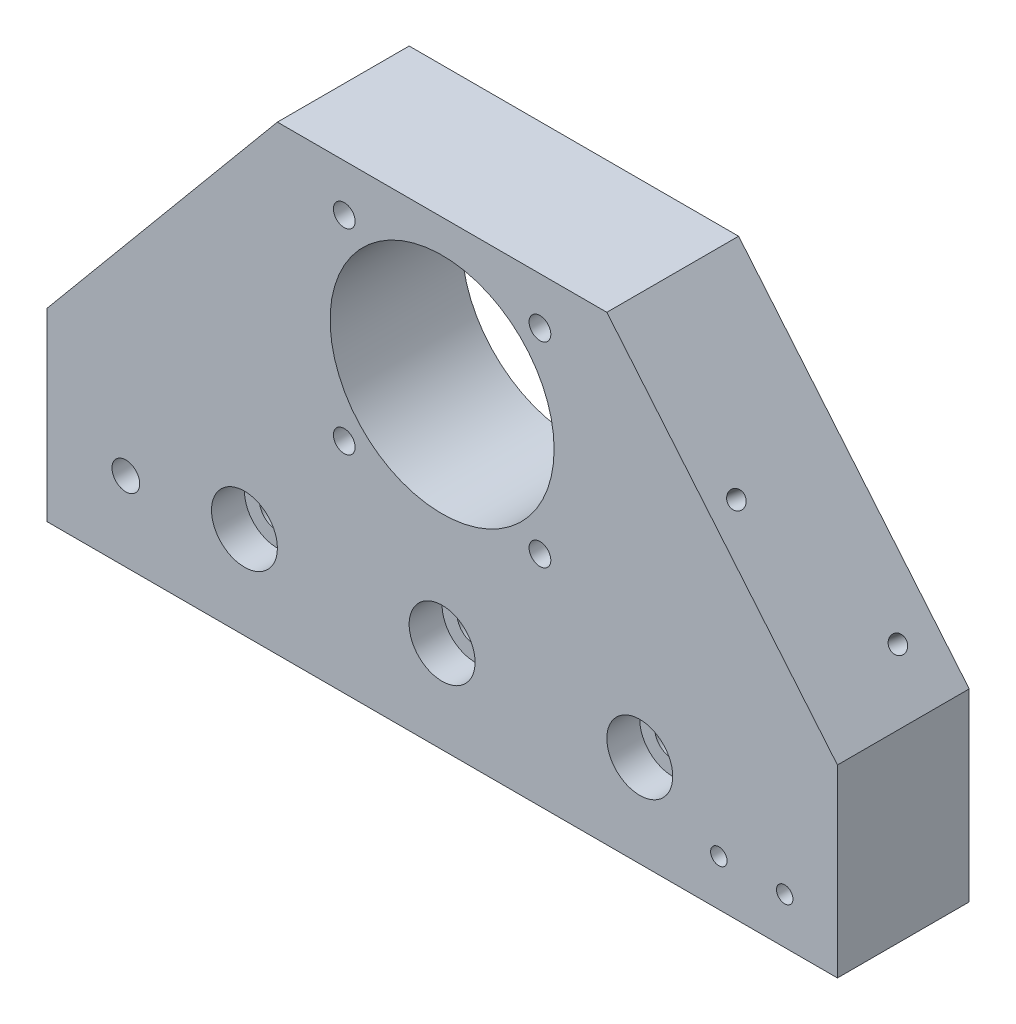
from build123d import *

# Parameters (mm, degrees)
BOSS_EXTRUDE1_DEPTH            = 20
CBORE_FOR_M5_SHCS1_D           = 5.5
CBORE_FOR_M5_SHCS1_CBORE_D     = 10
CBORE_FOR_M5_SHCS1_CBORE_DEPTH = 5
SKETCH4_R                      = 17
CUT_EXTRUDE1_DEPTH             = 95.339811321
M4_TAPPED_HOLE1_D              = 3.3
M4_TAPPED_HOLE2_D              = 3.3
M4_TAPPED_HOLE2_DEPTH          = 15
M4_TAPPED_HOLE2_TIP            = 0.991420021
M3_TAPPED_HOLE1_D              = 2.5
M3_TAPPED_HOLE1_DEPTH          = 7.5
M3_TAPPED_HOLE1_TIP            = 0.751075774
M3_TAPPED_HOLE2_D              = 2.5
M3_TAPPED_HOLE2_DEPTH          = 11.5
M3_TAPPED_HOLE2_TIP            = 0.751075774
M5_TAPPED_HOLE1_D              = 4.2


with BuildPart() as part:
    # Sketch1 → Boss-Extrude1 (new body)
    with BuildSketch(Plane.XY):
        Polygon((60, 0), (-60, 0), (-60, 28), (-25, 70), (25, 70), (60, 28), align=None)
    extrude(amount=BOSS_EXTRUDE1_DEPTH)

    # CBORE for M5 SHCS1 (through all)
    with Locations(Plane(origin=(-30, 14, 20), x_dir=(1, 0, 0), z_dir=(0, 0, 1))):
        with Locations((0, 0), (30, 0), (60, 0)):
            CounterBoreHole(CBORE_FOR_M5_SHCS1_D / 2, CBORE_FOR_M5_SHCS1_CBORE_D / 2, CBORE_FOR_M5_SHCS1_CBORE_DEPTH)

    # Sketch4 → Cut-Extrude1 (cut, through all)
    with BuildSketch(Plane.XY.offset(20)):
        with Locations((0, 48)):
            Circle(SKETCH4_R)
    extrude(amount=-CUT_EXTRUDE1_DEPTH, mode=Mode.SUBTRACT)

    # M4 Tapped Hole1 (through all)
    with Locations(Plane(origin=(-14.849242405, 62.849242405, 20), x_dir=(1, 0, 0), z_dir=(0, 0, 1))):
        with Locations((0, 0), (29.69848481, 0), (29.69848481, -29.69848481), (0, -29.69848481)):
            Hole(M4_TAPPED_HOLE1_D / 2)

    # M4 Tapped Hole2
    with Locations(Plane(origin=(0, 0, 0), x_dir=(-1, 0, 0), z_dir=(0, -1, 0))):
        with Locations((20, -10), (-20, -10)):
            Hole(M4_TAPPED_HOLE2_D / 2, depth=M4_TAPPED_HOLE2_DEPTH)
            with Locations((0, 0, -(M4_TAPPED_HOLE2_DEPTH + M4_TAPPED_HOLE2_TIP / 2))):  # 118° drill point
                Cone(0, M4_TAPPED_HOLE2_D / 2, M4_TAPPED_HOLE2_TIP, mode=Mode.SUBTRACT)

    # M3 Tapped Hole1
    with Locations(Plane(origin=(42, 7, 20), x_dir=(1, 0, 0), z_dir=(0, 0, 1))):
        with Locations((0, 0), (10, 0)):
            Hole(M3_TAPPED_HOLE1_D / 2, depth=M3_TAPPED_HOLE1_DEPTH)
            with Locations((0, 0, -(M3_TAPPED_HOLE1_DEPTH + M3_TAPPED_HOLE1_TIP / 2))):  # 118° drill point
                Cone(0, M3_TAPPED_HOLE1_D / 2, M3_TAPPED_HOLE1_TIP, mode=Mode.SUBTRACT)

    # M3 Tapped Hole2
    with Locations(Plane(origin=(49.180327869, 40.983606557, 0), x_dir=(0, 0, -1), z_dir=(0.7682212795973757, 0.6401843996644799, 0))):
        with Locations((-16, 13.299131849), (-5.7, -8.900868151)):
            Hole(M3_TAPPED_HOLE2_D / 2, depth=M3_TAPPED_HOLE2_DEPTH)
            with Locations((0, 0, -(M3_TAPPED_HOLE2_DEPTH + M3_TAPPED_HOLE2_TIP / 2))):  # 118° drill point
                Cone(0, M3_TAPPED_HOLE2_D / 2, M3_TAPPED_HOLE2_TIP, mode=Mode.SUBTRACT)

    # M5 Tapped Hole1 (through all)
    with Locations(Plane.XY.offset(20)):
        with Locations((-48, 12)):
            Hole(M5_TAPPED_HOLE1_D / 2)


solid = part.part
